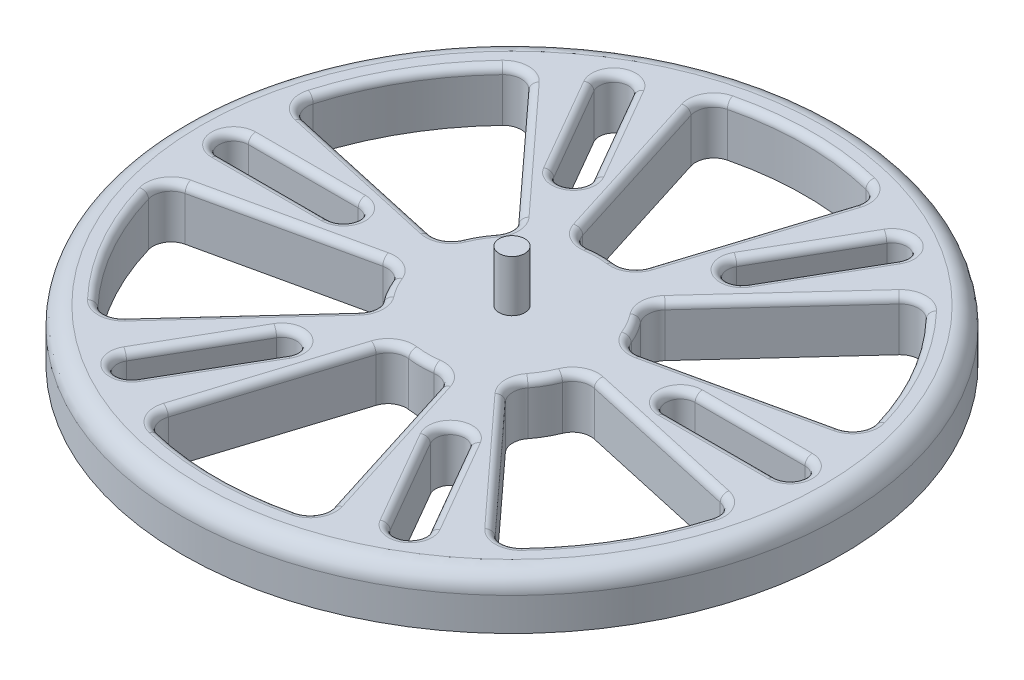
from build123d import *

# Parameters (mm, degrees)
ESQUISSE1_R        = 45
BOSS_EXTRU_1_DEPTH = 7
ESQUISSE2_R        = 1.75
BOSS_EXTRU_2_DEPTH = 7
CONG_1_R           = 2.5
CONG_2_R           = 1


with BuildPart() as part:
    # Esquisse1 → Boss.-Extru.1 (new body)
    with BuildSketch(Plane(origin=(0, 0, 0), x_dir=(1, 0, 0), z_dir=(0, 1, 0))):
        with Locations(Location((0, 0, 0), (0, 0, 270))):
            Circle(ESQUISSE1_R)
        with BuildLine():
            Line((-11.25138076, 35.684820737), (-4.447498753, 14.105663928))
            ThreePointArc((-4.447498753, 14.105663928), (-3.398977861, 12.744204695), (-1.719338647, 12.381190355))
            ThreePointArc((-1.719338647, 12.381190355), (0, 12.5), (1.719338647, 12.381190355))
            ThreePointArc((1.719338647, 12.381190355), (3.398977861, 12.744204695), (4.447498753, 14.105663928))
            Line((4.447498753, 14.105663928), (11.25138076, 35.684820737))
            ThreePointArc((11.25138076, 35.684820737), (11.044881321, 37.664273273), (9.458227608, 38.865690918))
            ThreePointArc((9.458227608, 38.865690918), (0, 40), (-9.458227608, 38.865690918))
            ThreePointArc((-9.458227608, 38.865690918), (-11.044881321, 37.664273273), (-11.25138076, 35.684820737))
        make_face(mode=Mode.SUBTRACT)
        with BuildLine():
            Line((14.439612675, 3.201185061), (36.529651667, 8.098428803))
            ThreePointArc((36.529651667, 8.098428803), (38.14065813, 9.266988831), (38.387789474, 11.241780075))
            ThreePointArc((38.387789474, 11.241780075), (34.641016151, 20), (28.929561866, 27.623910842))
            ThreePointArc((28.929561866, 27.623910842), (27.095776809, 28.397284442), (25.278270908, 27.586391934))
            Line((25.278270908, 27.586391934), (9.992113922, 10.904478867))
            ThreePointArc((9.992113922, 10.904478867), (9.337316086, 9.315703522), (9.862756054, 7.679586123))
            ThreePointArc((9.862756054, 7.679586123), (10.825317547, 6.25), (11.5820947, 4.701604232))
            ThreePointArc((11.5820947, 4.701604232), (12.736293948, 3.428501173), (14.439612675, 3.201185061))
        make_face(mode=Mode.SUBTRACT)
        with BuildLine():
            Line((9.992113922, -10.904478867), (25.278270908, -27.586391934))
            ThreePointArc((25.278270908, -27.586391934), (27.095776809, -28.397284442), (28.929561866, -27.623910842))
            ThreePointArc((28.929561866, -27.623910842), (34.641016151, -20), (38.387789474, -11.241780075))
            ThreePointArc((38.387789474, -11.241780075), (38.14065813, -9.266988831), (36.529651667, -8.098428803))
            Line((36.529651667, -8.098428803), (14.439612675, -3.201185061))
            ThreePointArc((14.439612675, -3.201185061), (12.736293948, -3.428501173), (11.5820947, -4.701604232))
            ThreePointArc((11.5820947, -4.701604232), (10.825317547, -6.25), (9.862756054, -7.679586123))
            ThreePointArc((9.862756054, -7.679586123), (9.337316086, -9.315703522), (9.992113922, -10.904478867))
        make_face(mode=Mode.SUBTRACT)
        with BuildLine():
            Line((-4.447498753, -14.105663928), (-11.25138076, -35.684820737))
            ThreePointArc((-11.25138076, -35.684820737), (-11.044881321, -37.664273273), (-9.458227608, -38.865690918))
            ThreePointArc((-9.458227608, -38.865690918), (0, -40), (9.458227608, -38.865690918))
            ThreePointArc((9.458227608, -38.865690918), (11.044881321, -37.664273273), (11.25138076, -35.684820737))
            Line((11.25138076, -35.684820737), (4.447498753, -14.105663928))
            ThreePointArc((4.447498753, -14.105663928), (3.398977861, -12.744204695), (1.719338647, -12.381190355))
            ThreePointArc((1.719338647, -12.381190355), (0, -12.5), (-1.719338647, -12.381190355))
            ThreePointArc((-1.719338647, -12.381190355), (-3.398977861, -12.744204695), (-4.447498753, -14.105663928))
        make_face(mode=Mode.SUBTRACT)
        with BuildLine():
            Line((-14.439612675, -3.201185061), (-36.529651667, -8.098428803))
            ThreePointArc((-36.529651667, -8.098428803), (-38.14065813, -9.266988831), (-38.387789474, -11.241780075))
            ThreePointArc((-38.387789474, -11.241780075), (-34.641016151, -20), (-28.929561866, -27.623910842))
            ThreePointArc((-28.929561866, -27.623910842), (-27.095776809, -28.397284442), (-25.278270908, -27.586391934))
            Line((-25.278270908, -27.586391934), (-9.992113922, -10.904478867))
            ThreePointArc((-9.992113922, -10.904478867), (-9.337316086, -9.315703522), (-9.862756054, -7.679586123))
            ThreePointArc((-9.862756054, -7.679586123), (-10.825317547, -6.25), (-11.5820947, -4.701604232))
            ThreePointArc((-11.5820947, -4.701604232), (-12.736293948, -3.428501173), (-14.439612675, -3.201185061))
        make_face(mode=Mode.SUBTRACT)
        with BuildLine():
            Line((-9.992113922, 10.904478867), (-25.278270908, 27.586391934))
            ThreePointArc((-25.278270908, 27.586391934), (-27.095776809, 28.397284442), (-28.929561866, 27.623910842))
            ThreePointArc((-28.929561866, 27.623910842), (-34.641016151, 20), (-38.387789474, 11.241780075))
            ThreePointArc((-38.387789474, 11.241780075), (-38.14065813, 9.266988831), (-36.529651667, 8.098428803))
            Line((-36.529651667, 8.098428803), (-14.439612675, 3.201185061))
            ThreePointArc((-14.439612675, 3.201185061), (-12.736293948, 3.428501173), (-11.5820947, 4.701604232))
            ThreePointArc((-11.5820947, 4.701604232), (-10.825317547, 6.25), (-9.862756054, 7.679586123))
            ThreePointArc((-9.862756054, 7.679586123), (-9.337316086, 9.315703522), (-9.992113922, 10.904478867))
        make_face(mode=Mode.SUBTRACT)
        with BuildLine():
            Line((9.767949192, 20.918584287), (17.267949192, 33.908965344))
            ThreePointArc((17.267949192, 33.908965344), (20, 34.641016151), (20.732050808, 31.908965344))
            Line((20.732050808, 31.908965344), (13.232050808, 18.918584287))
            ThreePointArc((13.232050808, 18.918584287), (10.5, 18.186533479), (9.767949192, 20.918584287))
        make_face(mode=Mode.SUBTRACT)
        with BuildLine():
            Line((23, 2), (38, 2))
            ThreePointArc((38, 2), (40, 0), (38, -2))
            Line((38, -2), (23, -2))
            ThreePointArc((23, -2), (21, 0), (23, 2))
        make_face(mode=Mode.SUBTRACT)
        with BuildLine():
            Line((13.232050808, -18.918584287), (20.732050808, -31.908965344))
            ThreePointArc((20.732050808, -31.908965344), (20, -34.641016151), (17.267949192, -33.908965344))
            Line((17.267949192, -33.908965344), (9.767949192, -20.918584287))
            ThreePointArc((9.767949192, -20.918584287), (10.5, -18.186533479), (13.232050808, -18.918584287))
        make_face(mode=Mode.SUBTRACT)
        with BuildLine():
            Line((-9.767949192, -20.918584287), (-17.267949192, -33.908965344))
            ThreePointArc((-17.267949192, -33.908965344), (-20, -34.641016151), (-20.732050808, -31.908965344))
            Line((-20.732050808, -31.908965344), (-13.232050808, -18.918584287))
            ThreePointArc((-13.232050808, -18.918584287), (-10.5, -18.186533479), (-9.767949192, -20.918584287))
        make_face(mode=Mode.SUBTRACT)
        with BuildLine():
            Line((-23, -2), (-38, -2))
            ThreePointArc((-38, -2), (-40, 0), (-38, 2))
            Line((-38, 2), (-23, 2))
            ThreePointArc((-23, 2), (-21, 0), (-23, -2))
        make_face(mode=Mode.SUBTRACT)
        with BuildLine():
            Line((-13.232050808, 18.918584287), (-20.732050808, 31.908965344))
            ThreePointArc((-20.732050808, 31.908965344), (-20, 34.641016151), (-17.267949192, 33.908965344))
            Line((-17.267949192, 33.908965344), (-9.767949192, 20.918584287))
            ThreePointArc((-9.767949192, 20.918584287), (-10.5, 18.186533479), (-13.232050808, 18.918584287))
        make_face(mode=Mode.SUBTRACT)
    extrude(amount=BOSS_EXTRU_1_DEPTH)

    # Esquisse2 → Boss.-Extru.2 (add)
    with BuildSketch(Plane(origin=(0, 7, 0), x_dir=(1, 0, 0), z_dir=(0, 1, 0))):
        with Locations(Location((0, 0, 0), (0, 0, 270))):
            Circle(ESQUISSE2_R)
    extrude(amount=BOSS_EXTRU_2_DEPTH)

    # Congé1
    cong_1_edges = [part.edges().sort_by_distance(p)[0] for p in [
        (0, 7, -45),
    ]]
    fillet(cong_1_edges, radius=CONG_1_R)

    # Congé2
    cong_2_edges = [part.edges().sort_by_distance(p)[0] for p in [
        (-34.641016151, 7, 20),
        (-27.095776809, 7, 28.397284442),
        (-17.635192415, 7, 19.2454354),
        (-9.337316086, 7, 9.315703522),
        (-10.825317547, 7, 6.25),
        (-12.736293948, 7, 3.428501173),
        (-25.484632171, 7, 5.649806932),
        (-38.14065813, 7, 9.266988831),
        (-34.641016151, 7, -20),
        (-38.14065813, 7, -9.266988831),
        (-25.484632171, 7, -5.649806932),
        (-12.736293948, 7, -3.428501173),
        (-10.825317547, 7, -6.25),
        (-9.337316086, 7, -9.315703522),
        (-17.635192415, 7, -19.2454354),
        (-27.095776809, 7, -28.397284442),
        (11.044881321, 7, -37.664273273),
        (0, 7, -40),
        (-11.044881321, 7, -37.664273273),
        (-7.849439756, 7, -24.895242332),
        (10.5, 7, -18.186533479),
        (16.982050808, 7, -25.413774815),
        (20, 7, -34.641016151),
        (13.517949192, 7, -27.413774815),
        (-3.398977861, 7, -12.744204695),
        (0, 7, -12.5),
        (3.398977861, 7, -12.744204695),
        (7.849439756, 7, -24.895242332),
        (21, 7, 0),
        (30.5, 7, 2),
        (40, 7, 0),
        (30.5, 7, -2),
        (10.5, 7, 18.186533479),
        (13.517949192, 7, 27.413774815),
        (20, 7, 34.641016151),
        (16.982050808, 7, 25.413774815),
        (-10.5, 7, 18.186533479),
        (-16.982050808, 7, 25.413774815),
        (-20, 7, 34.641016151),
        (-13.517949192, 7, 27.413774815),
        (-21, 7, 0),
        (-30.5, 7, -2),
        (-40, 7, 0),
        (-30.5, 7, 2),
        (-10.5, 7, -18.186533479),
        (-13.517949192, 7, -27.413774815),
        (-20, 7, -34.641016151),
        (-16.982050808, 7, -25.413774815),
        (34.641016151, 7, -20),
        (27.095776809, 7, -28.397284442),
        (17.635192415, 7, -19.2454354),
        (9.337316086, 7, -9.315703522),
        (10.825317547, 7, -6.25),
        (12.736293948, 7, -3.428501173),
        (25.484632171, 7, -5.649806932),
        (38.14065813, 7, -9.266988831),
        (34.641016151, 7, 20),
        (38.14065813, 7, 9.266988831),
        (25.484632171, 7, 5.649806932),
        (12.736293948, 7, 3.428501173),
        (10.825317547, 7, 6.25),
        (9.337316086, 7, 9.315703522),
        (17.635192415, 7, 19.2454354),
        (27.095776809, 7, 28.397284442),
        (0, 7, 40),
        (11.044881321, 7, 37.664273273),
        (7.849439756, 7, 24.895242332),
        (3.398977861, 7, 12.744204695),
        (0, 7, 12.5),
        (-3.398977861, 7, 12.744204695),
        (-7.849439756, 7, 24.895242332),
        (-11.044881321, 7, 37.664273273),
    ]]
    fillet(cong_2_edges, radius=CONG_2_R)


solid = part.part
